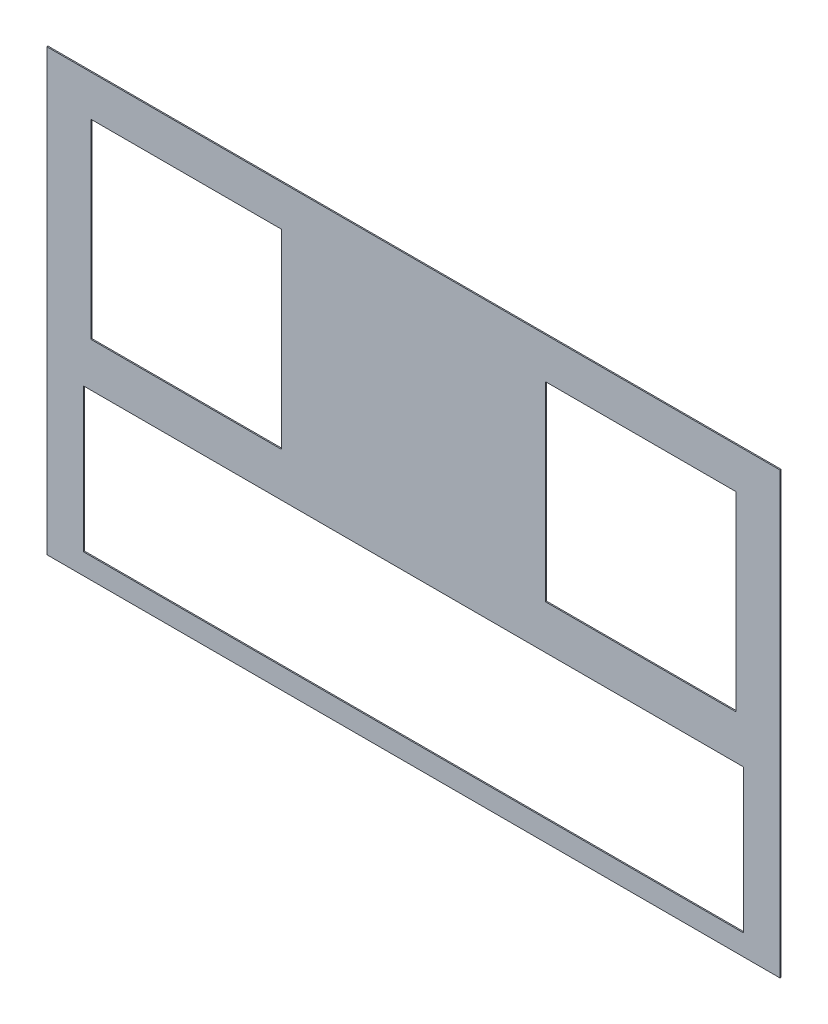
from build123d import *

# Parameters (mm, degrees)
BOSS_EXTRUDE1_DEPTH = 4
SKETCH3_W           = 650
SKETCH3_H           = 650
SKETCH3_W_2         = 2250
SKETCH3_H_2         = 490
CUT_EXTRUDE1_DEPTH  = 1458.743461656


with BuildPart() as part:
    # Sketch1 → Boss-Extrude1 (new body)
    with BuildSketch(Plane.XY):
        Polygon((-1250, 750), (0, 750), (1250, 750), (1250, -750), (-1250, -750), align=None)
    extrude(amount=BOSS_EXTRUDE1_DEPTH)

    # Sketch3 → Cut-Extrude1 (cut, through all)
    with BuildSketch(Plane.XY.offset(4)):
        with Locations((-775, 286)):
            Rectangle(SKETCH3_W, SKETCH3_H)
        with Locations((775, 286)):
            Rectangle(SKETCH3_W, SKETCH3_H)
        with Locations((0, -434)):
            Rectangle(SKETCH3_W_2, SKETCH3_H_2)
    extrude(amount=-CUT_EXTRUDE1_DEPTH, mode=Mode.SUBTRACT)


solid = part.part
